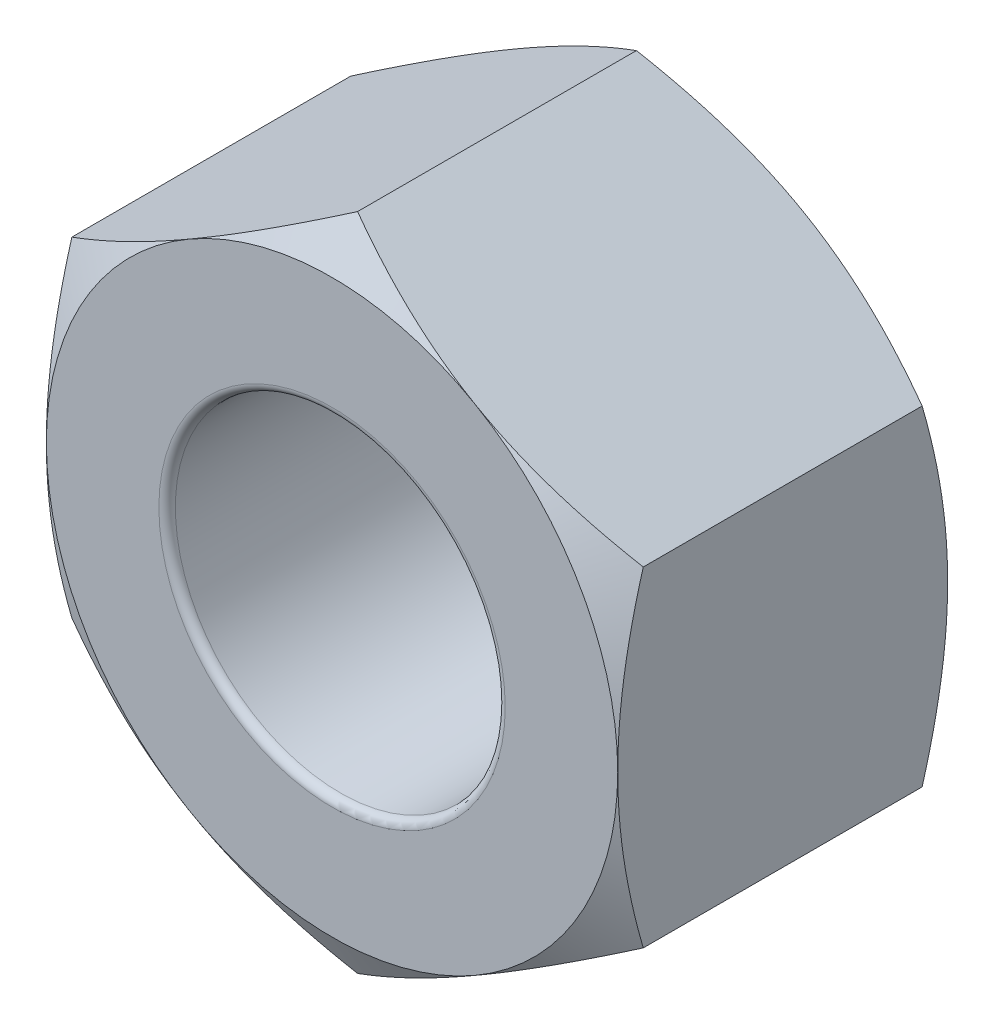
from build123d import *

# Parameters (mm, degrees)
SKETCH1_R           = 1
BOSS_EXTRUDE1_DEPTH = 2
SKETCH7_OUTSIDE_W   = 13.524
SKETCH7_OUTSIDE_H   = 14.06
SKETCH7_OUTSIDE_R   = 1.732050808
CUT_EXTRUDE1_DEPTH  = 2
CUT_EXTRUDE1_DRAFT  = -60
SKETCH9_OUTSIDE_W   = 13.524
SKETCH9_OUTSIDE_H   = 14.06
SKETCH9_OUTSIDE_R   = 1.732050808
CUT_EXTRUDE2_DEPTH  = 2
CUT_EXTRUDE2_DRAFT  = -60
FILLET1_R           = 0.05


with BuildPart() as part:
    # Sketch1 → Boss-Extrude1 (new body)
    with BuildSketch(Plane.XY):
        Polygon((0, 2), (-1.732050808, 1), (-1.732050808, -1), (0, -2), (1.732050808, -1), (1.732050808, 1), align=None)
        Circle(SKETCH1_R, mode=Mode.SUBTRACT)
    extrude(amount=BOSS_EXTRUDE1_DEPTH)


with BuildPart() as cut_extrude1_tool:
    # Sketch7 outside → Cut-Extrude1 (with draft: the straight prism first)
    with BuildSketch(Plane.XY.offset(2)):
        Rectangle(SKETCH7_OUTSIDE_W, SKETCH7_OUTSIDE_H)
        Circle(SKETCH7_OUTSIDE_R, mode=Mode.SUBTRACT)
    extrude(amount=-CUT_EXTRUDE1_DEPTH)
    # Cut-Extrude1: the draft: its side faces are tilted about the plane it starts from
    cut_extrude1_sides = [cut_extrude1_tool.faces().sort_by_distance(p)[0] for p in [
        (0, -7.03, 1),
        (6.762, 0, 1),
        (0, 7.03, 1),
        (-6.762, 0, 1),
        (-1.732050808, 0, 1),
    ]]
    draft(cut_extrude1_sides, Plane.XY.offset(2), CUT_EXTRUDE1_DRAFT)


with BuildPart() as part_1:
    add(part.part)

    # Cut-Extrude1: cut by cut_extrude1_tool
    add(cut_extrude1_tool.part, mode=Mode.SUBTRACT)


with BuildPart() as cut_extrude2_tool:
    # Sketch9 outside → Cut-Extrude2 (with draft: the straight prism first)
    with BuildSketch(Plane(origin=(0, 0, 0), x_dir=(-1, 0, 0), z_dir=(0, 0, -1))):
        Rectangle(SKETCH9_OUTSIDE_W, SKETCH9_OUTSIDE_H)
        Circle(SKETCH9_OUTSIDE_R, mode=Mode.SUBTRACT)
    extrude(amount=-CUT_EXTRUDE2_DEPTH)
    # Cut-Extrude2: the draft: its side faces are tilted about the plane it starts from
    cut_extrude2_sides = [cut_extrude2_tool.faces().sort_by_distance(p)[0] for p in [
        (0, -7.03, 1),
        (-6.762, 0, 1),
        (0, 7.03, 1),
        (6.762, 0, 1),
        (1.732050808, 0, 1),
    ]]
    draft(cut_extrude2_sides, Plane(origin=(0, 0, 0), x_dir=(-1, 0, 0), z_dir=(0, 0, -1)), CUT_EXTRUDE2_DRAFT)


with BuildPart() as part_2:
    add(part_1.part)

    # Cut-Extrude2: cut by cut_extrude2_tool
    add(cut_extrude2_tool.part, mode=Mode.SUBTRACT)

    # Fillet1
    fillet1_edges = [part_2.edges().sort_by_distance(p)[0] for p in [
        (-1, 0, 0),
        (-1, 0, 2),
    ]]
    fillet(fillet1_edges, radius=FILLET1_R)


solid = part_2.part
